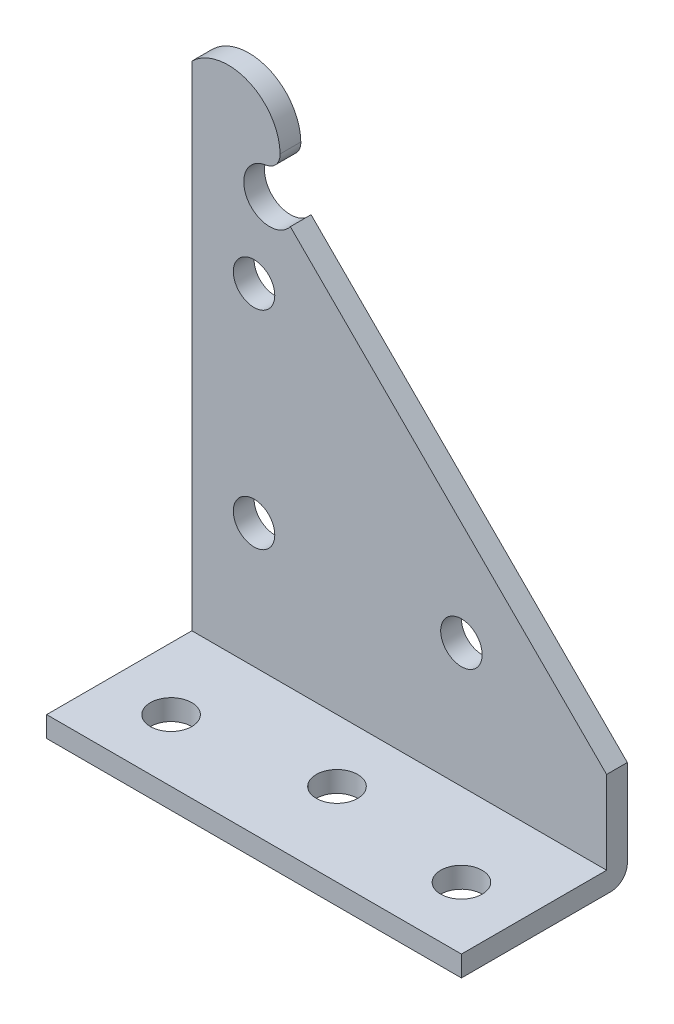
from build123d import *

# Parameters (mm, degrees)
SKETCH1_W           = 63.5
SKETCH1_H           = 25.4
SKETCH1_R           = 3.175
BOSS_EXTRUDE1_DEPTH = 3.175
SKETCH2_R           = 3.175
BOSS_EXTRUDE2_DEPTH = 3.175
FILLET2_R           = 2.54


with BuildPart() as part:
    # Sketch1 → Boss-Extrude1 (new body)
    with BuildSketch(Plane(origin=(0, 0, 0), x_dir=(1, 0, 0), z_dir=(0, 1, 0))):
        Rectangle(SKETCH1_W, SKETCH1_H)
        with Locations(Location((-22.225, -3.175, 0), (0, 0, 270))):
            Circle(SKETCH1_R, mode=Mode.SUBTRACT)
        with Locations(Location((0, 0, 0), (0, 0, 270))):
            Circle(SKETCH1_R, mode=Mode.SUBTRACT)
        with Locations(Location((22.225, -3.175, 0), (0, 0, 90))):
            Circle(SKETCH1_R, mode=Mode.SUBTRACT)
    extrude(amount=BOSS_EXTRUDE1_DEPTH)

    # Sketch2 → Boss-Extrude2 (add)
    with BuildSketch(Plane.XY.offset(-12.7)):
        with BuildLine():
            Line((-31.75, 0), (-31.75, 78.705067014))
            ThreePointArc((-31.75, 78.705067014), (-23.163673383, 80.377738088), (-18.238159017, 73.148482141))
            ThreePointArc((-18.238159017, 73.148482141), (-18.843460583, 71.462906002), (-20.410488317, 70.595737627))
            ThreePointArc((-20.410488317, 70.595737627), (-23.244591892, 64.65221549), (-16.669658329, 64.294658329))
            Line((-16.669658329, 64.294658329), (31.75, 15.875))
            Line((31.75, 15.875), (31.75, 0))
            Line((31.75, 0), (-31.75, 0))
        make_face()
        with Locations((-22.225, 53.975)):
            Circle(SKETCH2_R, mode=Mode.SUBTRACT)
        with Locations((-22.225, 22.225)):
            Circle(SKETCH2_R, mode=Mode.SUBTRACT)
        with Locations((9.525, 22.225)):
            Circle(SKETCH2_R, mode=Mode.SUBTRACT)
    extrude(amount=BOSS_EXTRUDE2_DEPTH)

    # Fillet2
    fillet2_edges = [part.edges().sort_by_distance(p)[0] for p in [
        (0, 0, -12.7),
    ]]
    fillet(fillet2_edges, radius=FILLET2_R)


solid = part.part
